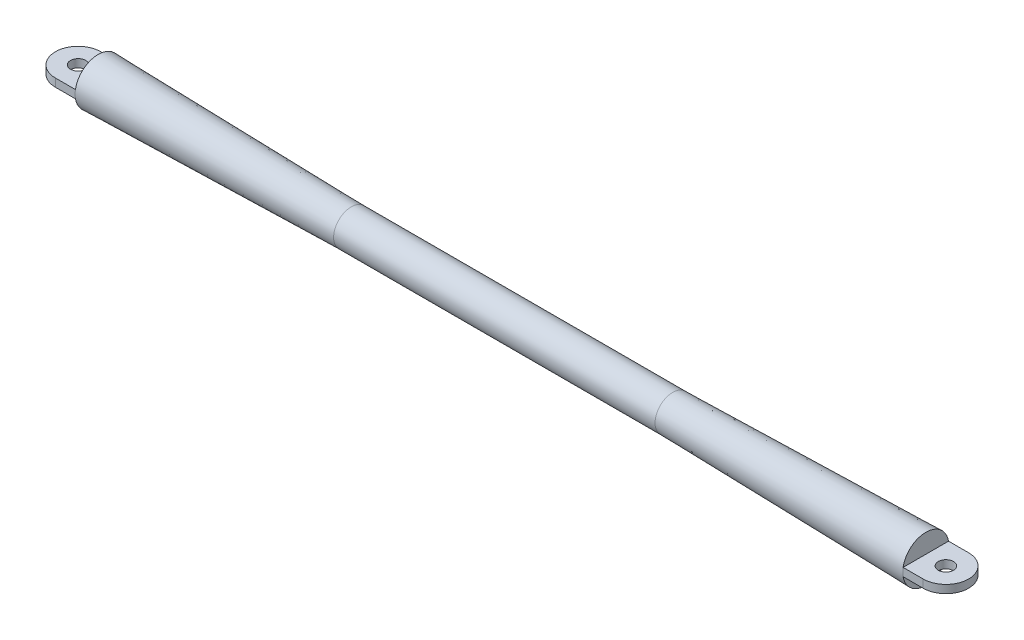
from build123d import *

# Parameters (mm, degrees)
SKETCH2_W          = 128.615835123
SKETCH2_H          = 55.94056642
CUT_EXTRUDE1_DEPTH = 750
CUT_EXTRUDE2_DEPTH = 750
SKETCH4_R          = 9.5
CUT_EXTRUDE3_DEPTH = 571.004949753


with BuildPart() as part:
    # Sketch1 → Revolve1 (revolve)
    with BuildSketch(Plane(origin=(0, 0, 0), x_dir=(1, 0, 0), z_dir=(0, 1, 0)), mode=Mode.PRIVATE) as revolve1_sk:
        Polygon((0, 0), (575, 0), (575, 30), (200, 22), (0, 22), align=None)
    revolve1 = revolve(revolve1_sk.sketch.rotate(Axis((0, 0, 0), (1, 0, 0)), 180), axis=Axis((0, 0, 0), (1, 0, 0)))

    # Sketch2 → Cut-Extrude1 (cut, symmetric)
    with BuildSketch(Plane.XY):
        with Locations((579.307917562, -32.97028321)):
            Rectangle(SKETCH2_W, SKETCH2_H)
        with Locations((579.307917562, 32.97028321)):
            Rectangle(SKETCH2_W, SKETCH2_H)
    cut_extrude1 = extrude(amount=CUT_EXTRUDE1_DEPTH, both=True, mode=Mode.SUBTRACT)

    # Sketch3 → Cut-Extrude2 (cut, symmetric)
    with BuildSketch(Plane(origin=(0, 5, 0), x_dir=(1, 0, 0), z_dir=(0, 1, 0))):
        with BuildLine():
            Line((515, 28.281414392), (540, 28.281414392))
            ThreePointArc((540, 28.281414392), (568.281414392, 0), (540, -28.281414392))
            Line((540, -28.281414392), (515, -28.281414392))
            Line((515, -28.281414392), (515, -67.597566928))
            Line((515, -67.597566928), (604.606661549, -67.597566928))
            Line((604.606661549, -67.597566928), (604.606661549, 61.560196149))
            Line((604.606661549, 61.560196149), (515, 61.560196149))
            Line((515, 61.560196149), (515, 28.281414392))
        make_face()
    cut_extrude2 = extrude(amount=CUT_EXTRUDE2_DEPTH, both=True, mode=Mode.SUBTRACT)

    # Sketch4 → Cut-Extrude3 (cut, through all)
    with BuildSketch(Plane(origin=(0, 5, 0), x_dir=(1, 0, 0), z_dir=(0, 1, 0))):
        with Locations(Location((540, 0, 0), (0, 0, 270))):
            Circle(SKETCH4_R)
    cut_extrude3 = extrude(amount=-CUT_EXTRUDE3_DEPTH, mode=Mode.SUBTRACT)

    # Mirror2: Revolve1, Cut-Extrude1, Cut-Extrude2, Cut-Extrude3 across plane
    add(revolve1.mirror(Plane(origin=(0, 0, -22), x_dir=(0, 0, 1), z_dir=(1, 0, 0))))
    add(cut_extrude1.mirror(Plane(origin=(0, 0, -22), x_dir=(0, 0, 1), z_dir=(1, 0, 0))), mode=Mode.SUBTRACT)
    add(cut_extrude2.mirror(Plane(origin=(0, 0, -22), x_dir=(0, 0, 1), z_dir=(1, 0, 0))), mode=Mode.SUBTRACT)
    add(cut_extrude3.mirror(Plane(origin=(0, 0, -22), x_dir=(0, 0, 1), z_dir=(1, 0, 0))), mode=Mode.SUBTRACT)


solid = part.part
